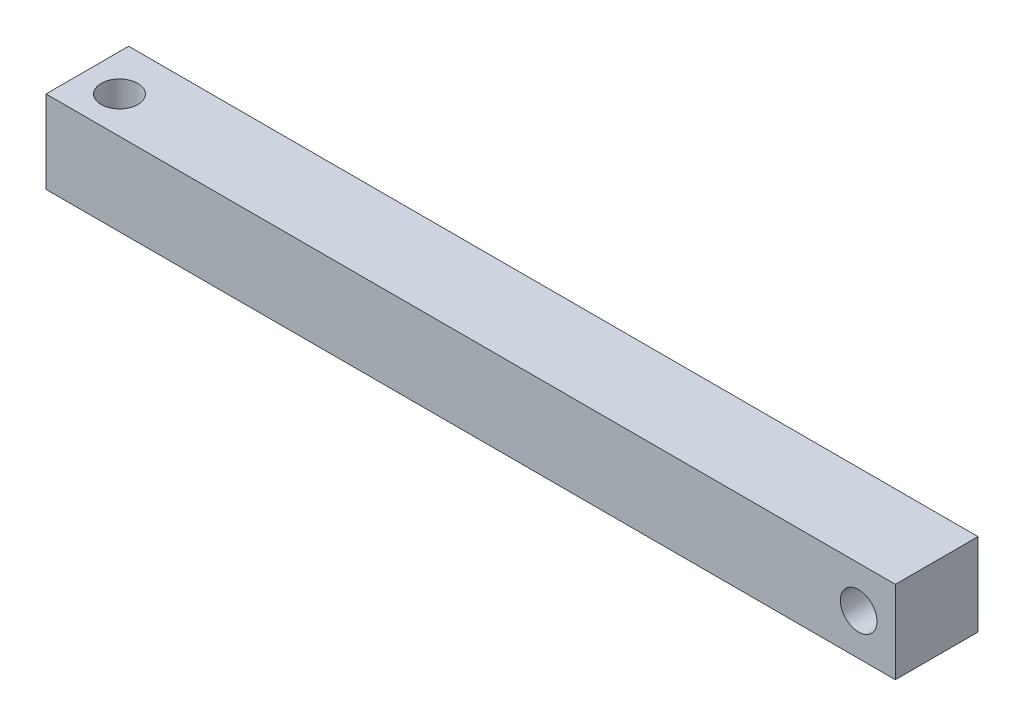
from build123d import *

# Parameters (mm, degrees)
SKETCH1_W           = 37
SKETCH1_H           = 3.6
BOSS_EXTRUDE1_DEPTH = 3.6
SKETCH2_R           = 0.8
CUT_EXTRUDE1_DEPTH  = 3.6
SKETCH3_R           = 0.8
CUT_EXTRUDE2_DEPTH  = 3.6


with BuildPart() as part:
    # Sketch1 → Boss-Extrude1 (new body)
    with BuildSketch(Plane.XY):
        with Locations((-23.279872622, 10.227539088)):
            Rectangle(SKETCH1_W, SKETCH1_H)
    extrude(amount=BOSS_EXTRUDE1_DEPTH)

    # Sketch2 → Cut-Extrude1 (cut)
    with BuildSketch(Plane.XY.offset(3.6)):
        with Locations((-6.379872622, 10.227539088)):
            Circle(SKETCH2_R)
    extrude(amount=-CUT_EXTRUDE1_DEPTH, mode=Mode.SUBTRACT)

    # Sketch3 → Cut-Extrude2 (cut)
    with BuildSketch(Plane.XZ.offset(-8.427539088)):
        with Locations(Location((-40.179872622, 2, 0), (0, 0, 270))):
            Circle(SKETCH3_R)
    extrude(amount=-CUT_EXTRUDE2_DEPTH, mode=Mode.SUBTRACT)


solid = part.part
